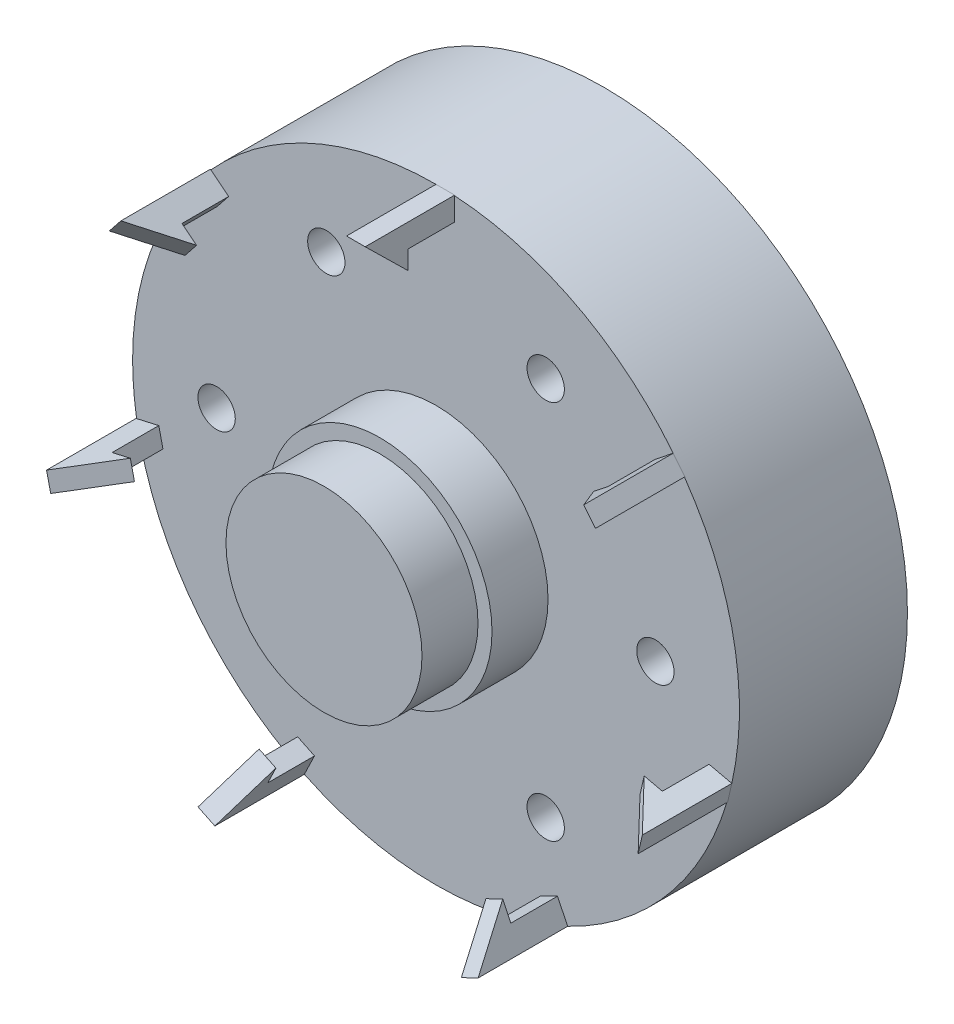
from build123d import *

# Parameters (mm, degrees)
SKETCH2_R           = 32.5
BOSS_EXTRUDE1_DEPTH = 10
BOSS_EXTRUDE2_DEPTH = 2
CIRPATTERN1_COUNT   = 7
SKETCH4_R           = 12
BOSS_EXTRUDE3_DEPTH = 6
SKETCH5_R           = 10.5
BOSS_EXTRUDE4_DEPTH = 12
BOSS_EXTRUDE5_START = 8
SKETCH7_R           = 32.5
BOSS_EXTRUDE5_DEPTH = 8
SKETCH6_R           = 2
CUT_EXTRUDE1_DEPTH  = 50.360915713


with BuildPart() as part:
    # Sketch2 → Boss-Extrude1 (new body)
    with BuildSketch(Plane.XY):
        Circle(SKETCH2_R)
    extrude(amount=BOSS_EXTRUDE1_DEPTH)

    # Sketch3 → Boss-Extrude2 (add)
    with BuildSketch(Plane(origin=(0, 0, 0), x_dir=(0, 0, -1), z_dir=(1, 0, 0))):
        Polygon((-10, 32.5), (-19.587933614, 32.5), (-15, 28), (-15, 30), (-10, 30), align=None)
    boss_extrude2 = extrude(amount=BOSS_EXTRUDE2_DEPTH)

    # CirPattern1: Boss-Extrude2 ×7 about axis
    cirpattern1_axis = Axis((0, 0, 0), (0, 0, 1))
    for i in range(1, CIRPATTERN1_COUNT):
        add(boss_extrude2.rotate(cirpattern1_axis, i * 360 / CIRPATTERN1_COUNT))

    # Sketch4 → Boss-Extrude3 (add)
    with BuildSketch(Plane.XY.offset(10)):
        Circle(SKETCH4_R)
    extrude(amount=BOSS_EXTRUDE3_DEPTH)

    # Sketch5 → Boss-Extrude4 (add)
    with BuildSketch(Plane.XY.offset(10)):
        Circle(SKETCH5_R)
    extrude(amount=BOSS_EXTRUDE4_DEPTH)

    # Sketch7 → Boss-Extrude5 (add)
    with BuildSketch(Plane(origin=(0, 0, 0), x_dir=(-1, 0, 0), z_dir=(0, 0, -1)).offset(BOSS_EXTRUDE5_START)):
        Circle(SKETCH7_R)
    extrude(amount=-BOSS_EXTRUDE5_DEPTH)

    # Sketch6 → Cut-Extrude1 (cut, through all)
    with BuildSketch(Plane.XY.offset(10)):
        with Locations((23.5, 0)):
            Circle(SKETCH6_R)
        with Locations((11.75, -20.351596989)):
            Circle(SKETCH6_R)
        with Locations((-11.75, -20.351596989)):
            Circle(SKETCH6_R)
        with Locations((-23.5, 0)):
            Circle(SKETCH6_R)
        with Locations((-11.75, 20.351596989)):
            Circle(SKETCH6_R)
        with Locations((11.75, 20.351596989)):
            Circle(SKETCH6_R)
    extrude(amount=-CUT_EXTRUDE1_DEPTH, mode=Mode.SUBTRACT)


solid = part.part
